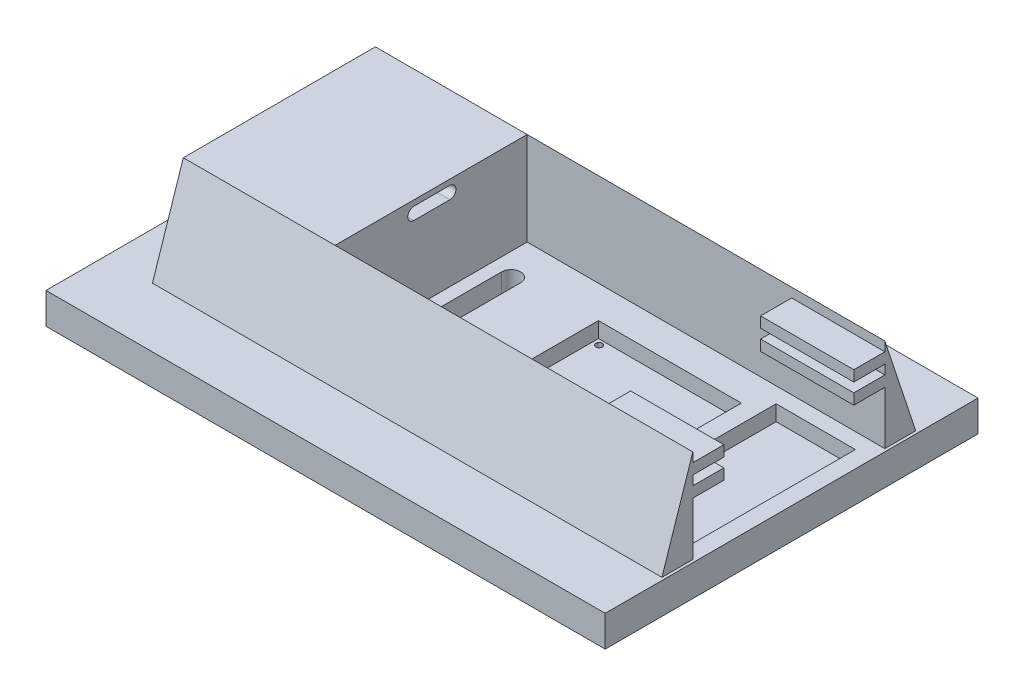
from build123d import *

# Parameters (mm, degrees)
SKETCH1_W                           = 180
SKETCH1_H                           = 120
BOSS_EXTRUDE1_DEPTH                 = 10
SKETCH2_W                           = 48.844317462
SKETCH2_H                           = 61.818589288
BOSS_EXTRUDE2_DEPTH                 = 30
SKETCH3_W                           = 27
SKETCH3_H                           = 27
CUT_EXTRUDE1_DEPTH                  = 10
CUT_EXTRUDE5_DEPTH                  = 171.851904114
TAP_DRILL_FOR_M2_5_TAP1_D           = 2.05
TAP_DRILL_FOR_M2_5_TAP1_DEPTH       = 5
TAP_DRILL_FOR_M2_5_TAP1_CSINK_D     = 2.1
TAP_DRILL_FOR_M2_5_TAP1_CSINK_ANGLE = 92
TAP_DRILL_FOR_M2_5_TAP1_TIP         = 0.615882135
CUT_EXTRUDE6_DEPTH                  = 113.249721603
BOSS_EXTRUDE3_DEPTH                 = 49
SKETCH14_W                          = 46
SKETCH14_H                          = 41
CUT_EXTRUDE8_DEPTH                  = 5
TAP_DRILL_FOR_M2_5_TAP2_D           = 2.05
TAP_DRILL_FOR_M2_5_TAP2_DEPTH       = 5
TAP_DRILL_FOR_M2_5_TAP2_CSINK_D     = 2.1
TAP_DRILL_FOR_M2_5_TAP2_CSINK_ANGLE = 92
TAP_DRILL_FOR_M2_5_TAP2_TIP         = 0.615882135
BOSS_EXTRUDE5_DEPTH                 = 115
BOSS_EXTRUDE6_DEPTH                 = 115
SKETCH29_W                          = 30
SKETCH29_H                          = 3.45
BOSS_EXTRUDE10_DEPTH                = 10
SKETCH34_R                          = 2
CUT_EXTRUDE10_DEPTH                 = 5
SKETCH25_R                          = 2
CUT_EXTRUDE11_DEPTH                 = 5
SKETCH36_W                          = 25.507224214
SKETCH36_H                          = 51.818589288
CUT_EXTRUDE12_DEPTH                 = 5
CUT_EXTRUDE14_DEPTH                 = 171.851904114


with BuildPart() as part:
    # Sketch1 → Boss-Extrude1 (new body)
    with BuildSketch(Plane(origin=(0, 0, 0), x_dir=(1, 0, 0), z_dir=(0, 1, 0))):
        Rectangle(SKETCH1_W, SKETCH1_H)
    extrude(amount=BOSS_EXTRUDE1_DEPTH)

    # Sketch2 → Boss-Extrude2 (add)
    with BuildSketch(Plane(origin=(0, 10, 0), x_dir=(1, 0, 0), z_dir=(0, 1, 0))):
        with Locations((-50.466101441, 0)):
            Rectangle(SKETCH2_W, SKETCH2_H)
    extrude(amount=BOSS_EXTRUDE2_DEPTH)

    # Sketch3 → Cut-Extrude1 (cut)
    with BuildSketch(Plane.ZY.offset(74.888260172)):
        with Locations((0, 25)):
            Rectangle(SKETCH3_W, SKETCH3_H)
    extrude(amount=-CUT_EXTRUDE1_DEPTH, mode=Mode.SUBTRACT)

    # Sketch4 → Cut-Extrude5 (cut, through all)
    with BuildSketch(Plane.ZY.offset(64.888260172)):
        with BuildLine():
            Line((-6.024531525, 38.226394973), (5.549516036, 38.226394973))
            ThreePointArc((5.549516036, 38.226394973), (6.551598076, 37.224312933), (5.549516036, 36.222230893))
            Line((5.549516036, 36.222230893), (-6.024531525, 36.222230893))
            ThreePointArc((-6.024531525, 36.222230893), (-7.026613565, 37.224312933), (-6.024531525, 38.226394973))
        make_face()
    extrude(amount=-CUT_EXTRUDE5_DEPTH, mode=Mode.SUBTRACT)

    # Tap Drill for M2.5 Tap1
    with Locations(Plane(origin=(-64.888260172, 36.953397965, -12.070360422), x_dir=(0, 0, -1), z_dir=(-1, 0, 0))):
        with Locations((0, 0), (-24.059553717, -0.049505255), (-23.988973263, 23.863567836), (-0.227588633, 23.863567836)):
            CounterSinkHole(TAP_DRILL_FOR_M2_5_TAP1_D / 2, TAP_DRILL_FOR_M2_5_TAP1_CSINK_D / 2, depth=TAP_DRILL_FOR_M2_5_TAP1_DEPTH, counter_sink_angle=TAP_DRILL_FOR_M2_5_TAP1_CSINK_ANGLE)
            with Locations((0, 0, -(TAP_DRILL_FOR_M2_5_TAP1_DEPTH + TAP_DRILL_FOR_M2_5_TAP1_TIP / 2))):  # 118° drill point
                Cone(0, TAP_DRILL_FOR_M2_5_TAP1_D / 2, TAP_DRILL_FOR_M2_5_TAP1_TIP, mode=Mode.SUBTRACT)

    # Sketch9 → Cut-Extrude6 (cut, through all)
    with BuildSketch(Plane(origin=(0, 10, 0), x_dir=(1, 0, 0), z_dir=(0, 1, 0))):
        with BuildLine():
            Line((-21.846384178, -19.079811509), (-21.846384178, 18.507417164))
            ThreePointArc((-21.846384178, 18.507417164), (-18.793614336, 21.560187005), (-15.740844495, 18.507417164))
            Line((-15.740844495, 18.507417164), (-15.740844495, -19.079811509))
            ThreePointArc((-15.740844495, -19.079811509), (-18.793614336, -22.13258135), (-21.846384178, -19.079811509))
        make_face()
    extrude(amount=-CUT_EXTRUDE6_DEPTH, mode=Mode.SUBTRACT)

    # Sketch10 → Boss-Extrude3 (add)
    with BuildSketch(Plane.ZY.offset(74.888260172)):
        Polygon((30.909294644, 10), (30.909294644, 40), (40.847177304, 10), align=None)
    boss_extrude3 = extrude(amount=-BOSS_EXTRUDE3_DEPTH)

    # Mirror2: Boss-Extrude3 across plane
    add(boss_extrude3.mirror(Plane.XY))

    # Sketch14 → Cut-Extrude8 (cut)
    with BuildSketch(Plane(origin=(0, 10, 0), x_dir=(1, 0, 0), z_dir=(0, 1, 0))):
        with Locations((30.328073167, 0)):
            Rectangle(SKETCH14_W, SKETCH14_H)
    extrude(amount=-CUT_EXTRUDE8_DEPTH, mode=Mode.SUBTRACT)

    # Tap Drill for M2.5 Tap2
    with Locations(Plane(origin=(9.553554548, 5, 18.196456661), x_dir=(0, 0, 1), z_dir=(0, 1, 0))):
        with Locations((0, 0), (-36.962901754, -0.27584255), (-36.549137929, 41.997028299), (0.551685101, 41.997028299)):
            CounterSinkHole(TAP_DRILL_FOR_M2_5_TAP2_D / 2, TAP_DRILL_FOR_M2_5_TAP2_CSINK_D / 2, depth=TAP_DRILL_FOR_M2_5_TAP2_DEPTH, counter_sink_angle=TAP_DRILL_FOR_M2_5_TAP2_CSINK_ANGLE)
            with Locations((0, 0, -(TAP_DRILL_FOR_M2_5_TAP2_DEPTH + TAP_DRILL_FOR_M2_5_TAP2_TIP / 2))):  # 118° drill point
                Cone(0, TAP_DRILL_FOR_M2_5_TAP2_D / 2, TAP_DRILL_FOR_M2_5_TAP2_TIP, mode=Mode.SUBTRACT)

    # Sketch18 → Boss-Extrude5 (add)
    with BuildSketch(Plane(origin=(-25.888260172, 0, 0), x_dir=(0, 0, -1), z_dir=(1, 0, 0))):
        Polygon((40.847177304, 10), (30.909294644, 10), (30.909294644, 40), align=None)
    extrude(amount=BOSS_EXTRUDE5_DEPTH)

    # Sketch19 → Boss-Extrude6 (add)
    with BuildSketch(Plane(origin=(-25.888260172, 0, 0), x_dir=(0, 0, -1), z_dir=(1, 0, 0))):
        Polygon((-30.909294644, 10), (-40.847177304, 10), (-30.909294644, 40), align=None)
    extrude(amount=BOSS_EXTRUDE6_DEPTH)

    # Sketch29 → Boss-Extrude10 (add)
    with BuildSketch(Plane(origin=(0, 0, 30.909294644), x_dir=(-1, 0, 0), z_dir=(0, 0, -1))):
        with Locations((-74.111739828, 35.275)):
            Rectangle(SKETCH29_W, SKETCH29_H)
        with Locations((-74.111739828, 28.825)):
            Rectangle(SKETCH29_W, SKETCH29_H)
    boss_extrude10 = extrude(amount=BOSS_EXTRUDE10_DEPTH)

    # Mirror3: Boss-Extrude10 across plane
    add(boss_extrude10.mirror(Plane.XY))

    # Sketch34 → Cut-Extrude10 (cut)
    with BuildSketch(Plane.XZ):
        with Locations(Location((-85, 55, 0), (0, 0, 270))):
            Circle(SKETCH34_R)
    cut_extrude10 = extrude(amount=-CUT_EXTRUDE10_DEPTH, mode=Mode.SUBTRACT)

    # Sketch25 → Cut-Extrude11 (cut)
    with BuildSketch(Plane.XZ):
        with Locations(Location((85, 55, 0), (0, 0, 270))):
            Circle(SKETCH25_R)
    cut_extrude11 = extrude(amount=-CUT_EXTRUDE11_DEPTH, mode=Mode.SUBTRACT)

    # Mirror4: Cut-Extrude10, Cut-Extrude11 across plane
    add(cut_extrude10.mirror(Plane.XY), mode=Mode.SUBTRACT)
    add(cut_extrude11.mirror(Plane.XY), mode=Mode.SUBTRACT)

    # Sketch36 → Cut-Extrude12 (cut)
    with BuildSketch(Plane(origin=(0, 10, 0), x_dir=(1, 0, 0), z_dir=(0, 1, 0))):
        with Locations((71.865351935, 0)):
            Rectangle(SKETCH36_W, SKETCH36_H)
    extrude(amount=-CUT_EXTRUDE12_DEPTH, mode=Mode.SUBTRACT)

    # Sketch39 → Cut-Extrude14 (cut, through all)
    with BuildSketch(Plane.ZY.offset(64.888260172)):
        with BuildLine():
            Line((-6.024531525, 38.195576912), (5.549516036, 38.195576912))
            ThreePointArc((5.549516036, 38.195576912), (7.522862055, 36.222230893), (5.549516036, 34.248884873))
            Line((5.549516036, 34.248884873), (-6.024531525, 34.248884873))
            ThreePointArc((-6.024531525, 34.248884873), (-7.997877545, 36.222230893), (-6.024531525, 38.195576912))
        make_face()
    extrude(amount=-CUT_EXTRUDE14_DEPTH, mode=Mode.SUBTRACT)


solid = part.part
